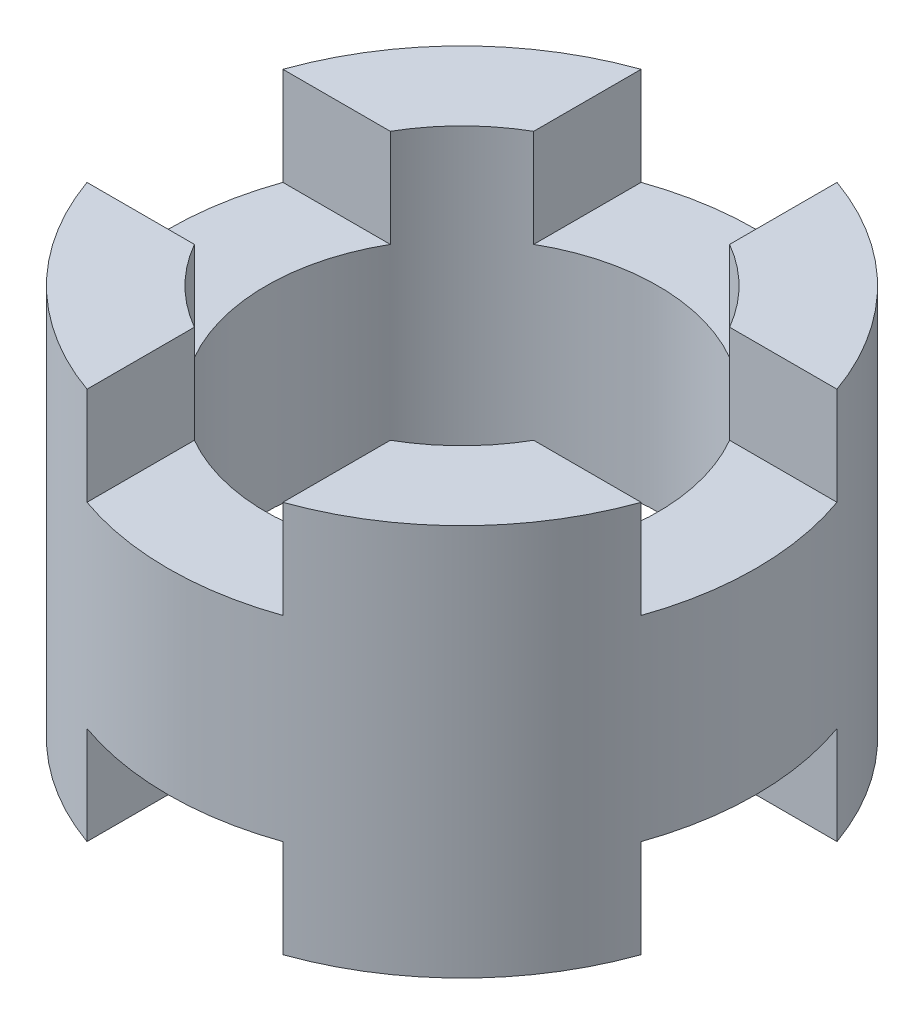
from build123d import *

# Parameters (mm, degrees)
SKETCH2_R           = 19.05
SKETCH2_R_2         = 12.7
BOSS_EXTRUDE2_DEPTH = 25.4
SKETCH4_W           = 76.2
SKETCH4_H           = 12.7
CUT_EXTRUDE7_DEPTH  = 6.35
CIRPATTERN1_COUNT   = 2
CIRPATTERN1_ANGLE   = 90
SKETCH8_W           = 78.396046772
SKETCH8_H           = 12.7
CUT_EXTRUDE9_DEPTH  = 6.35
CIRPATTERN2_COUNT   = 2
CIRPATTERN2_ANGLE   = 90


with BuildPart() as part:
    # Sketch2 → Boss-Extrude2 (new body)
    with BuildSketch(Plane(origin=(0, 0, 0), x_dir=(1, 0, 0), z_dir=(0, 1, 0))):
        with Locations(Location((0, 0, 0), (0, 0, 270))):
            Circle(SKETCH2_R)
        with Locations(Location((0, 0, 0), (0, 0, 270))):
            Circle(SKETCH2_R_2, mode=Mode.SUBTRACT)
    extrude(amount=BOSS_EXTRUDE2_DEPTH)

    # Sketch4 → Cut-Extrude7 (cut)
    with BuildSketch(Plane(origin=(0, 25.4, 0), x_dir=(1, 0, 0), z_dir=(0, 1, 0))):
        Rectangle(SKETCH4_W, SKETCH4_H)
    cut_extrude7 = extrude(amount=-CUT_EXTRUDE7_DEPTH, mode=Mode.SUBTRACT)

    # CirPattern1: Cut-Extrude7 ×2 about axis
    cirpattern1_axis = Axis((0, 25.4, 0), (0, 1, 0))
    for i in range(1, CIRPATTERN1_COUNT):
        add(cut_extrude7.rotate(cirpattern1_axis, i * CIRPATTERN1_ANGLE / (CIRPATTERN1_COUNT - 1)), mode=Mode.SUBTRACT)

    # Sketch8 → Cut-Extrude9 (cut)
    with BuildSketch(Plane.XZ):
        Rectangle(SKETCH8_W, SKETCH8_H)
    cut_extrude9 = extrude(amount=-CUT_EXTRUDE9_DEPTH, mode=Mode.SUBTRACT)

    # CirPattern2: Cut-Extrude9 ×2 about axis
    cirpattern2_axis = Axis((0, 25.4, 0), (0, -1, 0))
    for i in range(1, CIRPATTERN2_COUNT):
        add(cut_extrude9.rotate(cirpattern2_axis, i * CIRPATTERN2_ANGLE / (CIRPATTERN2_COUNT - 1)), mode=Mode.SUBTRACT)


solid = part.part
